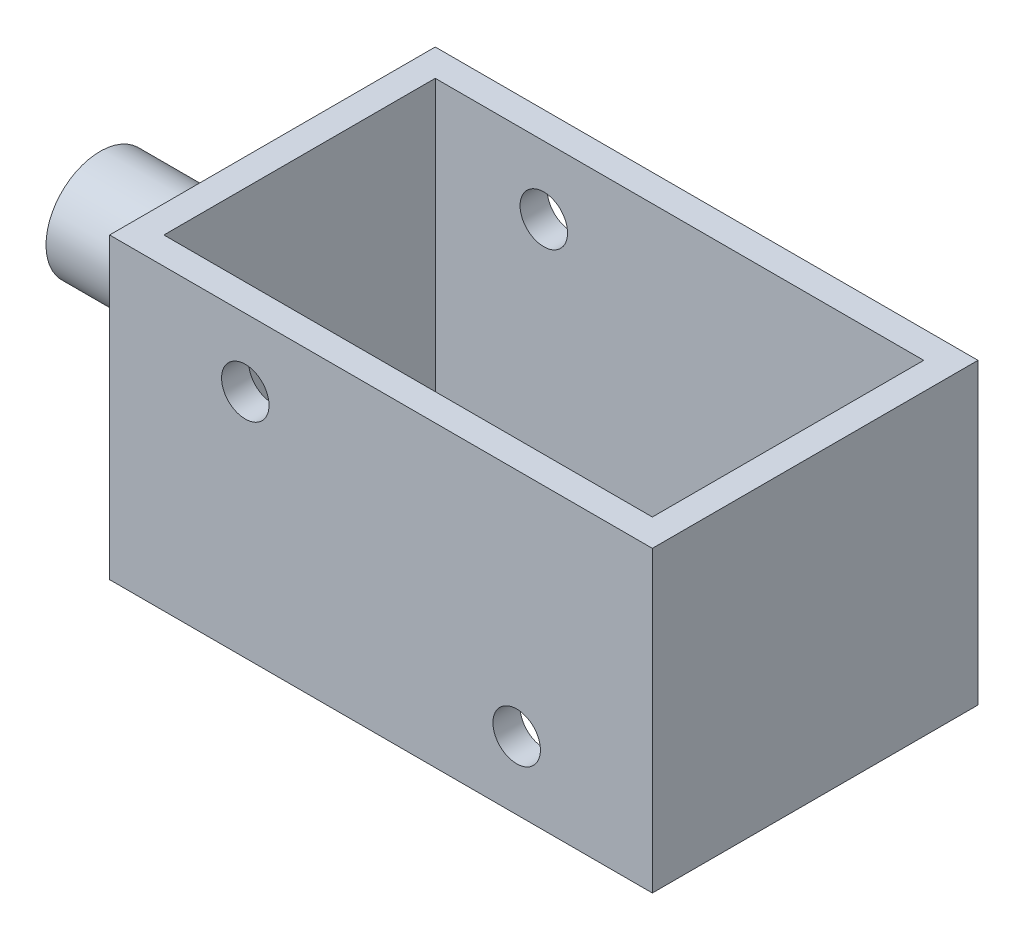
from build123d import *

# Parameters (mm, degrees)
SKETCH1_W           = 20
SKETCH1_H           = 11
BOSS_EXTRUDE1_DEPTH = 6
SHELL1_T            = -1
SKETCH2_R           = 1.9939
BOSS_EXTRUDE2_DEPTH = 6.35
SKETCH3_R           = 0.875
CUT_EXTRUDE1_DEPTH  = 24.963513933


with BuildPart() as part:
    # Sketch1 → Boss-Extrude1 (new, symmetric)
    with BuildSketch(Plane.XY):
        with Locations((10, 0)):
            Rectangle(SKETCH1_W, SKETCH1_H)
    extrude(amount=BOSS_EXTRUDE1_DEPTH, both=True)

    # Shell1
    shell1_openings = [part.faces().sort_by_distance(p)[0] for p in [
        (10, 5.5, 0),
        (10, -5.5, 0),
    ]]
    offset(amount=SHELL1_T, openings=shell1_openings, kind=Kind.INTERSECTION)

    # Sketch2 → Boss-Extrude2 (add)
    with BuildSketch(Plane.ZY):
        Circle(SKETCH2_R)
    extrude(amount=BOSS_EXTRUDE2_DEPTH)

    # Sketch3 → Cut-Extrude1 (cut, through all)
    with BuildSketch(Plane.XY.offset(6)):
        with Locations((5, 3)):
            Circle(SKETCH3_R)
        with Locations((15, -3)):
            Circle(SKETCH3_R)
    extrude(amount=-CUT_EXTRUDE1_DEPTH, mode=Mode.SUBTRACT)


solid = part.part
